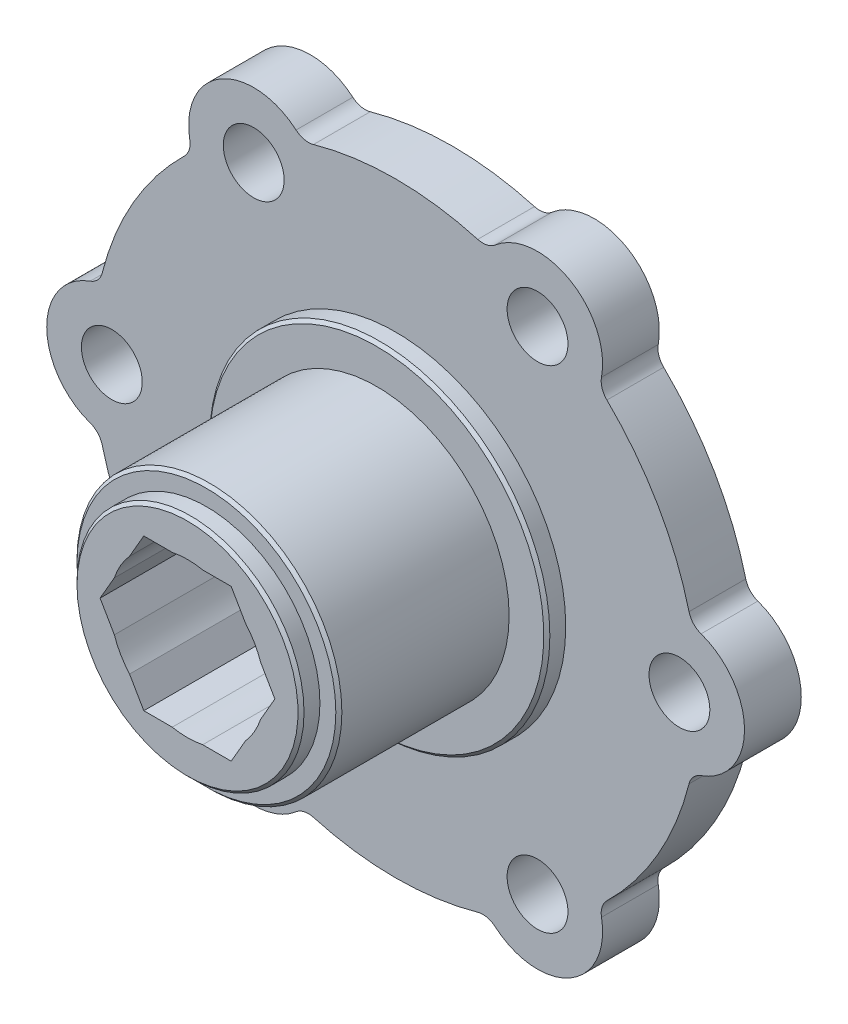
from build123d import *

# Parameters (mm, degrees)
BOSS_EXTRUDE1_DEPTH            = 4.7625
BOSS_EXTRUDE2_DEPTH            = 4.7625
BOSS_EXTRUDE3_DEPTH            = 4.7625
BOSS_EXTRUDE4_DEPTH            = 4.7625
BOSS_EXTRUDE5_DEPTH            = 4.7625
BOSS_EXTRUDE6_START            = -4.7625
BOSS_EXTRUDE6_DEPTH            = 4.7625
SKETCH7_R                      = 14.2748
BOSS_EXTRUDE7_DEPTH            = 1.5875
SKETCH8_R                      = 11.1125
BOSS_EXTRUDE8_DEPTH            = 14.2875
SKETCH9_R                      = 9.525
BOSS_EXTRUDE9_DEPTH            = 1.5875
BOSS_EXTRUDE10_START           = 1.5875
SKETCH10_R                     = 14.2748
BOSS_EXTRUDE10_DEPTH           = 1.5875
BOSS_EXTRUDE11_START           = 1.5875
SKETCH11_R                     = 9.525
BOSS_EXTRUDE11_DEPTH           = 1.5875
CUT_EXTRUDE1_DEPTH             = 83.427245149
F_7_0_201_DIAMETER_HOLE1_D     = 5.1054
F_7_0_201_DIAMETER_HOLE1_DEPTH = 7.9375
F_7_0_201_DIAMETER_HOLE2_D     = 5.1054
F_7_0_201_DIAMETER_HOLE2_DEPTH = 22.225
CHAMFER1_SIZE                  = 0.254
FILLET1_R                      = 1.5875


with BuildPart() as part:
    # Sketch1 → Boss-Extrude1 (new body)
    with BuildSketch(Plane.XY):
        with BuildLine():
            ThreePointArc((4.446778, 31.449222355), (0, 26.083229928), (4.446778, 20.7172375))
            ThreePointArc((4.446778, 20.7172375), (54.6735, 26.083229928), (4.446778, 31.449222355))
        make_face()
    extrude(amount=-BOSS_EXTRUDE1_DEPTH)

    # Sketch2 → Boss-Extrude2 (add)
    with BuildSketch(Plane.XY):
        with BuildLine():
            ThreePointArc((21.507224759, 1.899661769), (16.5735, 4.086184671), (12.213053241, 7.265654197))
            ThreePointArc((12.213053241, 7.265654197), (14.63675, 0.73163527), (21.507224759, 1.899661769))
        make_face()
    extrude(amount=-BOSS_EXTRUDE2_DEPTH)

    # Sketch3 → Boss-Extrude3 (add)
    with BuildSketch(Plane.XY):
        with BuildLine():
            ThreePointArc((46.333946759, 7.265654197), (41.9735, 4.086184671), (37.039775241, 1.899661769))
            ThreePointArc((37.039775241, 1.899661769), (43.91025, 0.73163527), (46.333946759, 7.265654197))
        make_face()
    extrude(amount=-BOSS_EXTRUDE3_DEPTH)

    # Sketch4 → Boss-Extrude4 (add)
    with BuildSketch(Plane.XY):
        with BuildLine():
            ThreePointArc((54.100222, 31.449222355), (54.6735, 26.083229928), (54.100222, 20.7172375))
            ThreePointArc((54.100222, 20.7172375), (58.547, 26.083229928), (54.100222, 31.449222355))
        make_face()
    extrude(amount=-BOSS_EXTRUDE4_DEPTH)

    # Sketch5 → Boss-Extrude5 (add)
    with BuildSketch(Plane.XY):
        with BuildLine():
            ThreePointArc((37.039775241, 50.266798086), (41.9735, 48.080275184), (46.333946759, 44.900805658))
            ThreePointArc((46.333946759, 44.900805658), (43.91025, 51.434824585), (37.039775241, 50.266798086))
        make_face()
    extrude(amount=-BOSS_EXTRUDE5_DEPTH)

    # Sketch6 → Boss-Extrude6 (add)
    with BuildSketch(Plane(origin=(0, 0, -4.7625), x_dir=(-1, 0, 0), z_dir=(0, 0, -1)).offset(BOSS_EXTRUDE6_START)):
        with BuildLine():
            ThreePointArc((-12.213053241, 44.900805658), (-14.63675, 51.434824585), (-21.507224759, 50.266798086))
            ThreePointArc((-21.507224759, 50.266798086), (-16.5735, 48.080275184), (-12.213053241, 44.900805658))
        make_face()
    extrude(amount=BOSS_EXTRUDE6_DEPTH)

    # Sketch7 → Boss-Extrude7 (add)
    with BuildSketch(Plane.XY):
        with Locations((29.2735, 26.083229928)):
            Circle(SKETCH7_R)
    extrude(amount=BOSS_EXTRUDE7_DEPTH)

    # Sketch8 → Boss-Extrude8 (add)
    with BuildSketch(Plane.XY.offset(1.5875)):
        with Locations((29.2735, 26.083229928)):
            Circle(SKETCH8_R)
    extrude(amount=BOSS_EXTRUDE8_DEPTH)

    # Sketch9 → Boss-Extrude9 (add)
    with BuildSketch(Plane.XY.offset(15.875)):
        with Locations((29.2735, 26.083229928)):
            Circle(SKETCH9_R)
    extrude(amount=BOSS_EXTRUDE9_DEPTH)

    # Sketch10 → Boss-Extrude10 (add)
    with BuildSketch(Plane(origin=(0, 0, -4.7625), x_dir=(-1, 0, 0), z_dir=(0, 0, -1)).offset(BOSS_EXTRUDE10_START)):
        with Locations(Location((-29.2735, 26.083229928, 0), (0, 0, 180))):
            Circle(SKETCH10_R)
    extrude(amount=-BOSS_EXTRUDE10_DEPTH)

    # Sketch11 → Boss-Extrude11 (add)
    with BuildSketch(Plane(origin=(0, 0, -6.35), x_dir=(-1, 0, 0), z_dir=(0, 0, -1)).offset(BOSS_EXTRUDE11_START)):
        with Locations(Location((-29.2735, 26.083229928, 0), (0, 0, 180))):
            Circle(SKETCH11_R)
    extrude(amount=-BOSS_EXTRUDE11_DEPTH)

    # Sketch12 → Cut-Extrude1 (cut, through all)
    with BuildSketch(Plane(origin=(0, 0, -7.9375), x_dir=(-1, 0, 0), z_dir=(0, 0, -1))):
        with BuildLine():
            Line((-24.412405788, 30.363567772), (-25.607325791, 32.433229928))
            Line((-25.607325791, 32.433229928), (-27.997165796, 32.433229928))
            ThreePointArc((-27.997165796, 32.433229928), (-29.2735, 32.560229928), (-30.549834204, 32.433229928))
            Line((-30.549834204, 32.433229928), (-32.939674209, 32.433229928))
            Line((-32.939674209, 32.433229928), (-34.134594212, 30.363567772))
            ThreePointArc((-34.134594212, 30.363567772), (-34.88274654, 29.321729928), (-35.410928416, 28.152892083))
            Line((-35.410928416, 28.152892083), (-36.605848419, 26.083229928))
            Line((-36.605848419, 26.083229928), (-35.410928416, 24.013567772))
            ThreePointArc((-35.410928416, 24.013567772), (-34.88274654, 22.844729928), (-34.134594212, 21.802892083))
            Line((-34.134594212, 21.802892083), (-32.939674209, 19.733229928))
            Line((-32.939674209, 19.733229928), (-30.549834204, 19.733229928))
            ThreePointArc((-30.549834204, 19.733229928), (-29.2735, 19.606229928), (-27.997165796, 19.733229928))
            Line((-27.997165796, 19.733229928), (-25.607325791, 19.733229928))
            Line((-25.607325791, 19.733229928), (-24.412405788, 21.802892083))
            ThreePointArc((-24.412405788, 21.802892083), (-23.66425346, 22.844729928), (-23.136071584, 24.013567772))
            Line((-23.136071584, 24.013567772), (-21.941151581, 26.083229928))
            Line((-21.941151581, 26.083229928), (-23.136071584, 28.152892083))
            ThreePointArc((-23.136071584, 28.152892083), (-23.66425346, 29.321729928), (-24.412405788, 30.363567772))
        make_face()
    extrude(amount=-CUT_EXTRUDE1_DEPTH, mode=Mode.SUBTRACT)

    # #7 (0.201) Diameter Hole1
    with Locations(Plane.XY):
        with Locations((41.17975, 46.705459855), (53.086, 26.083229928), (41.17975, 5.461), (17.36725, 5.461), (5.461, 26.083229928)):
            Hole(F_7_0_201_DIAMETER_HOLE1_D / 2, depth=F_7_0_201_DIAMETER_HOLE1_DEPTH)

    # #7 (0.201) Diameter Hole2
    with Locations(Plane(origin=(0, 0, -4.7625), x_dir=(-1, 0, 0), z_dir=(0, 0, -1))):
        with Locations((-17.36725, 46.705459855)):
            Hole(F_7_0_201_DIAMETER_HOLE2_D / 2, depth=F_7_0_201_DIAMETER_HOLE2_DEPTH)

    # Chamfer1
    chamfer1_edges = [part.edges().sort_by_distance(p)[0] for p in [
        (14.9987, 26.083229928, 1.5875),
        (18.161, 26.083229928, 15.875),
        (19.7485, 26.083229928, 17.4625),
        (14.9987, 26.083229928, -6.35),
        (19.7485, 26.083229928, -7.9375),
    ]]
    chamfer(chamfer1_edges, length=CHAMFER1_SIZE)

    # Fillet1
    fillet1_edges = [part.edges().sort_by_distance(p)[0] for p in [
        (21.507224759, 1.899661769, -2.38125),
        (12.213053241, 7.265654197, -2.38125),
        (46.333946759, 7.265654197, -2.38125),
        (37.039775241, 1.899661769, -2.38125),
        (54.100222, 31.449222355, -2.38125),
        (54.100222, 20.7172375, -2.38125),
        (37.039775241, 50.266798086, -2.38125),
        (46.333946759, 44.900805658, -2.38125),
        (12.213053241, 44.900805658, -2.38125),
        (21.507224759, 50.266798086, -2.38125),
        (4.446778, 20.7172375, -2.38125),
        (4.446778, 31.449222355, -2.38125),
    ]]
    fillet(fillet1_edges, radius=FILLET1_R)


solid = part.part
